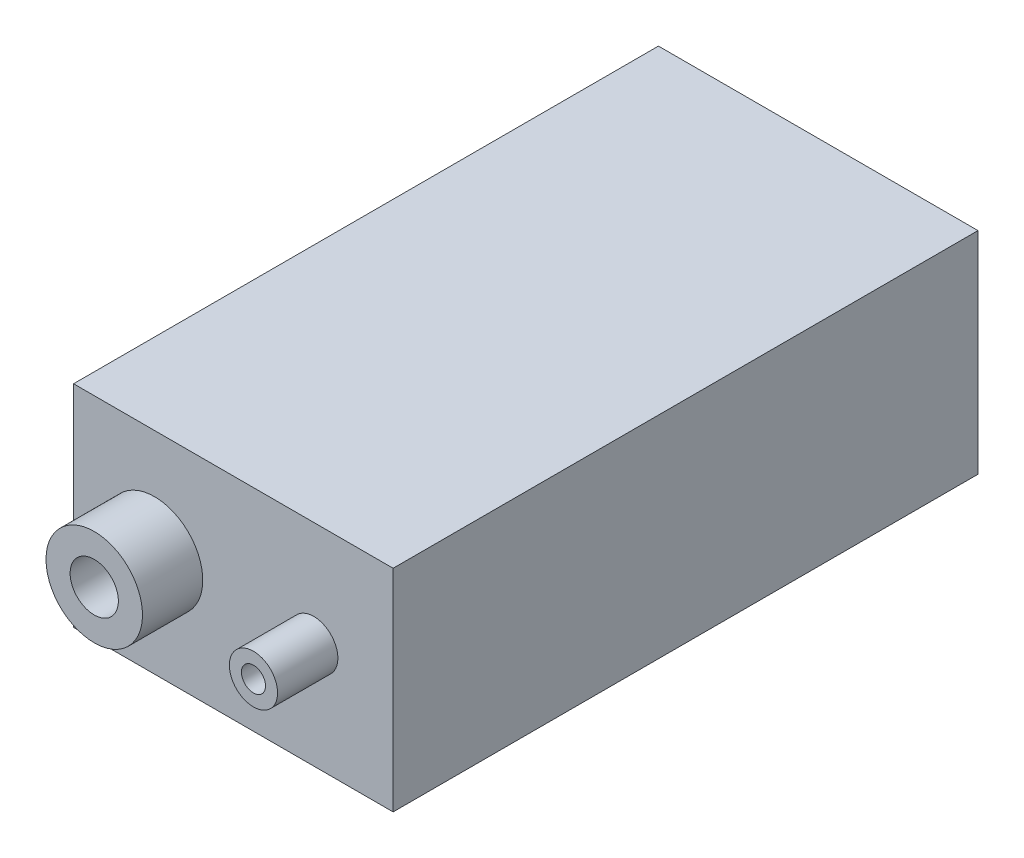
from build123d import *

# Parameters (mm, degrees)
SKETCH1_W           = 26.5
SKETCH1_H           = 17.5
BOSS_EXTRUDE1_DEPTH = 48.5
SKETCH2_R           = 2
SKETCH2_R_2         = 1
SKETCH2_R_3         = 4
BOSS_EXTRUDE2_DEPTH = 5


with BuildPart() as part:
    # Sketch1 → Boss-Extrude1 (new body)
    with BuildSketch(Plane.XY):
        with Locations((13.25, 8.75)):
            Rectangle(SKETCH1_W, SKETCH1_H)
    extrude(amount=BOSS_EXTRUDE1_DEPTH)

    # Sketch2 → Boss-Extrude2 (add)
    # profile 1 of 2: a face of its own
    with BuildSketch(Plane.XY.offset(48.5)):
        with Locations(Location((19.919028118, 8.75, 0), (0, 0, 180))):
            Circle(SKETCH2_R)
        with Locations((19.919028118, 8.75)):
            Circle(SKETCH2_R_2, mode=Mode.SUBTRACT)
    # profile 2 of 2: a face of its own
    with BuildSketch(Plane.XY.offset(48.5)):
        with Locations(Location((6.714907482, 8.75, 0), (0, 0, 180))):
            Circle(SKETCH2_R_3)
        with Locations(Location((6.714907482, 8.75, 0), (0, 0, 180))):
            Circle(SKETCH2_R, mode=Mode.SUBTRACT)
    extrude(amount=BOSS_EXTRUDE2_DEPTH)


solid = part.part
